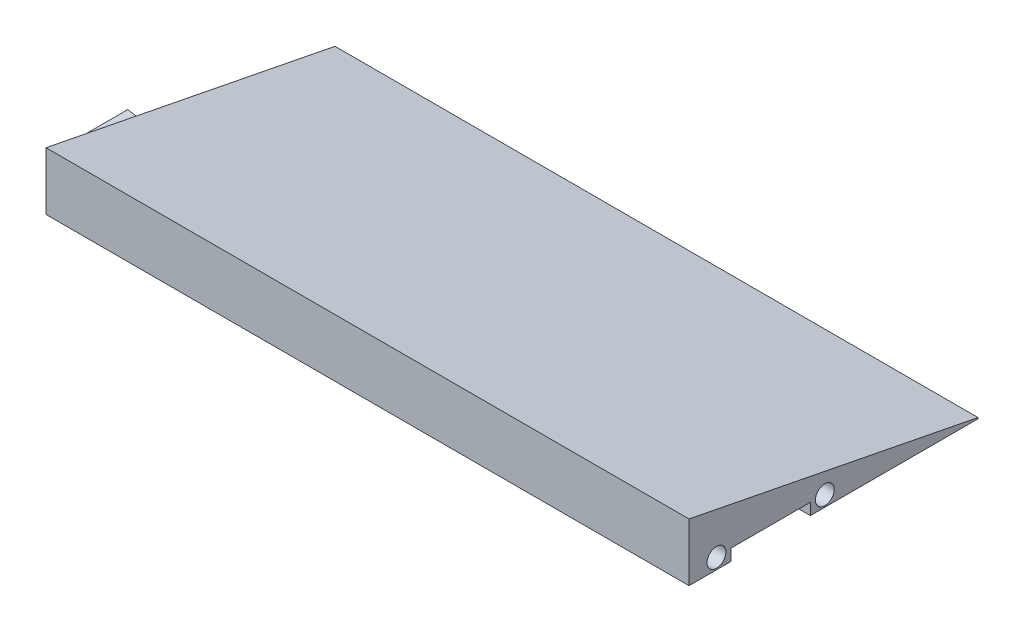
from build123d import *

# Parameters (mm, degrees)
BOSS_EXTRUDE1_DEPTH = 195.58
SKETCH2_R           = 3.3147
CUT_EXTRUDE1_DEPTH  = 38.1
SKETCH3_W           = 27.94
SKETCH3_H           = 4.064
CUT_EXTRUDE2_DEPTH  = 405.649982083
CUT_EXTRUDE3_DEPTH  = 4.064
SKETCH5_W           = 101.6
SKETCH5_H           = 20.32
CUT_EXTRUDE4_DEPTH  = 165.1
BOSS_EXTRUDE2_DEPTH = 4.064
SKETCH7_R           = 1.905
CUT_EXTRUDE5_DEPTH  = 12.7


with BuildPart() as part:
    # Sketch1 → Boss-Extrude1 (new, symmetric)
    with BuildSketch(Plane(origin=(0, 0, 0), x_dir=(0, 0, -1), z_dir=(1, 0, 0))):
        Polygon((0, 0), (0, 20.32), (101.6, 0.4), (101.6, 0), align=None)
    extrude(amount=BOSS_EXTRUDE1_DEPTH, both=True)

    # Sketch2 → Cut-Extrude1 (cut)
    with BuildSketch(Plane(origin=(195.58, 0, 0), x_dir=(0, 0, -1), z_dir=(1, 0, 0))):
        with Locations((9.652, 3.81)):
            Circle(SKETCH2_R)
        with Locations((47.752, 3.81)):
            Circle(SKETCH2_R)
    cut_extrude1 = extrude(amount=-CUT_EXTRUDE1_DEPTH, mode=Mode.SUBTRACT)

    # Mirror3: Cut-Extrude1 across plane
    add(cut_extrude1.mirror(Plane(origin=(0, 0, 0), x_dir=(0, 0, 1), z_dir=(1, 0, 0))), mode=Mode.SUBTRACT)

    # Sketch3 → Cut-Extrude2 (cut, through all)
    with BuildSketch(Plane.ZY.offset(195.58)):
        with Locations((-28.702, 2.032)):
            Rectangle(SKETCH3_W, SKETCH3_H)
    extrude(amount=-CUT_EXTRUDE2_DEPTH, mode=Mode.SUBTRACT)

    # Sketch4 → Cut-Extrude3 (cut)
    with BuildSketch(Plane.XZ):
        Polygon((5.40665728, -42.672), (-10.788895147, -42.672), (-12.114518933, -52.104303355), (6.732281067, -52.104303355), align=None)
        Polygon((139.397762134, -42.672), (123.202209707, -42.672), (121.87658592, -52.104303355), (140.72338592, -52.104303355), align=None)
        Polygon((121.87658592, -5.299696645), (123.202209707, -14.732), (139.397762134, -14.732), (140.72338592, -5.299696645), align=None)
        Polygon((-12.114518933, -5.299696645), (-10.788895147, -14.732), (5.40665728, -14.732), (6.732281067, -5.299696645), align=None)
        Polygon((72.402209707, -42.672), (56.20665728, -42.672), (54.881033493, -52.104303355), (73.727833493, -52.104303355), align=None)
        Polygon((54.881033493, -5.299696645), (56.20665728, -14.732), (72.402209707, -14.732), (73.727833493, -5.299696645), align=None)
    extrude(amount=-CUT_EXTRUDE3_DEPTH, mode=Mode.SUBTRACT)

    # Sketch5 → Cut-Extrude4 (cut)
    with BuildSketch(Plane.ZY.offset(195.58)):
        with Locations((-50.8, 10.16)):
            Rectangle(SKETCH5_W, SKETCH5_H)
    extrude(amount=-CUT_EXTRUDE4_DEPTH, mode=Mode.SUBTRACT)

    # Sketch6 → Boss-Extrude2 (add)
    with BuildSketch(Plane.XZ.offset(-4.064)):
        Polygon((-30.48, -20.447), (-30.48, -36.845752427), (-39.912303355, -38.171376213), (-39.912303355, -19.121376213), align=None)
    extrude(amount=-BOSS_EXTRUDE2_DEPTH)

    # Sketch7 → Cut-Extrude5 (cut)
    with BuildSketch(Plane.ZY.offset(30.48)):
        with Locations((-15.24, 8.128)):
            Circle(SKETCH7_R)
        with Locations((-45.72, 8.128)):
            Circle(SKETCH7_R)
    extrude(amount=-CUT_EXTRUDE5_DEPTH, mode=Mode.SUBTRACT)


solid = part.part
